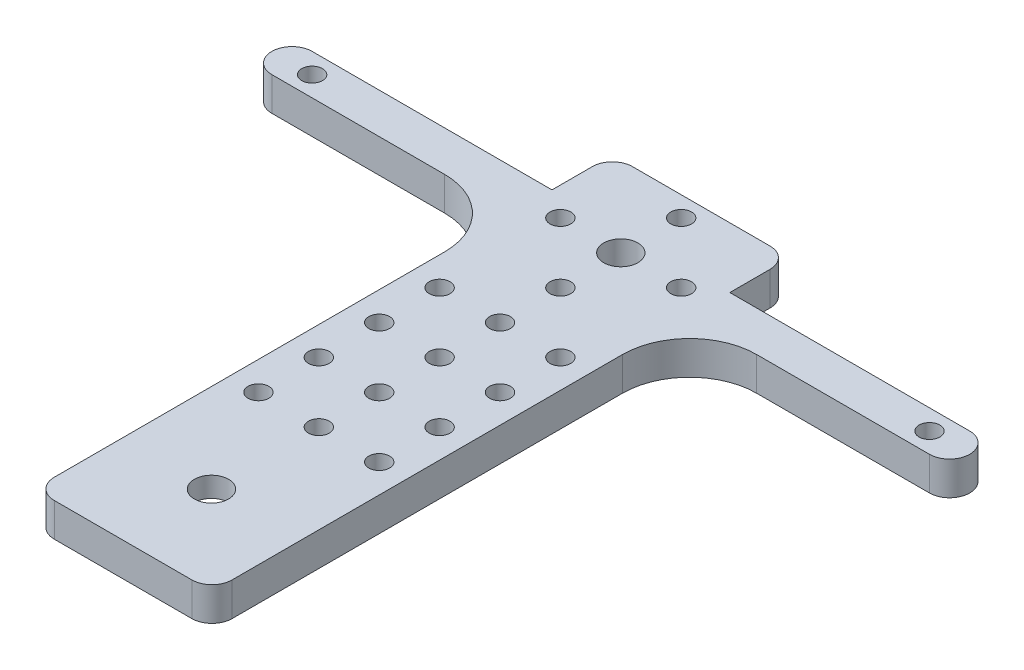
from build123d import *

# Parameters (mm, degrees)
SKETCH1_R           = 1.55
SKETCH1_R_2         = 2.55
BOSS_EXTRUDE1_DEPTH = 5
CUT_EXTRUDE1_DEPTH  = 2


with BuildPart() as part:
    # Sketch1 → Boss-Extrude1 (new body)
    with BuildSketch(Plane(origin=(0, 0, 0), x_dir=(1, 0, 0), z_dir=(0, 1, 0))):
        with BuildLine():
            Line((-13.25, 3), (-49, 3))
            ThreePointArc((-49, 3), (-52, 0), (-49, -3))
            Line((-49, -3), (-23.25, -3))
            ThreePointArc((-23.25, -3), (-16.178932188, -5.928932188), (-13.25, -13))
            Line((-13.25, -13), (-13.25, -71.173549983))
            ThreePointArc((-13.25, -71.173549983), (-12.371320344, -73.294870327), (-10.25, -74.173549983))
            Line((-10.25, -74.173549983), (10.25, -74.173549983))
            ThreePointArc((10.25, -74.173549983), (12.371320344, -73.294870327), (13.25, -71.173549983))
            Line((13.25, -71.173549983), (13.25, -13))
            ThreePointArc((13.25, -13), (16.178932188, -5.928932188), (23.25, -3))
            Line((23.25, -3), (49, -3))
            ThreePointArc((49, -3), (52, 0), (49, 3))
            Line((49, 3), (13.25, 3))
            Line((13.25, 3), (13.25, 9))
            ThreePointArc((13.25, 9), (12.371320344, 11.121320344), (10.25, 12))
            Line((10.25, 12), (-10.25, 12))
            ThreePointArc((-10.25, 12), (-12.371320344, 11.121320344), (-13.25, 9))
            Line((-13.25, 9), (-13.25, 3))
        make_face()
        with Locations(Location((-9, -45, 0), (0, 0, 270))):
            Circle(SKETCH1_R, mode=Mode.SUBTRACT)
        with Locations(Location((-9, -36, 0), (0, 0, 270))):
            Circle(SKETCH1_R, mode=Mode.SUBTRACT)
        with BuildLine():
            ThreePointArc((0, -46.55), (-1.55, -45), (0, -43.45))
            ThreePointArc((0, -43.45), (1.55, -45), (0, -46.55))
        make_face(mode=Mode.SUBTRACT)
        with Locations(Location((9, -45, 0), (0, 0, 270))):
            Circle(SKETCH1_R, mode=Mode.SUBTRACT)
        with BuildLine():
            ThreePointArc((0, -37.55), (-1.55, -36), (0, -34.45))
            ThreePointArc((0, -34.45), (1.55, -36), (0, -37.55))
        make_face(mode=Mode.SUBTRACT)
        with Locations(Location((9, -36, 0), (0, 0, 270))):
            Circle(SKETCH1_R, mode=Mode.SUBTRACT)
        with Locations(Location((-9, -27, 0), (0, 0, 270))):
            Circle(SKETCH1_R, mode=Mode.SUBTRACT)
        with Locations(Location((-9, -18, 0), (0, 0, 270))):
            Circle(SKETCH1_R, mode=Mode.SUBTRACT)
        with Locations(Location((-46, 0, 0), (0, 0, 270))):
            Circle(SKETCH1_R, mode=Mode.SUBTRACT)
        with BuildLine():
            ThreePointArc((0, -10.55), (-1.55, -9), (0, -7.45))
            ThreePointArc((0, -7.45), (1.55, -9), (0, -10.55))
        make_face(mode=Mode.SUBTRACT)
        with Locations(Location((-9, 0, 0), (0, 0, 270))):
            Circle(SKETCH1_R, mode=Mode.SUBTRACT)
        with BuildLine():
            ThreePointArc((0, -28.55), (-1.55, -27), (0, -25.45))
            ThreePointArc((0, -25.45), (1.55, -27), (0, -28.55))
        make_face(mode=Mode.SUBTRACT)
        with Locations(Location((9, -27, 0), (0, 0, 270))):
            Circle(SKETCH1_R, mode=Mode.SUBTRACT)
        with BuildLine():
            ThreePointArc((0, -19.55), (-1.55, -18), (0, -16.45))
            ThreePointArc((0, -16.45), (1.55, -18), (0, -19.55))
        make_face(mode=Mode.SUBTRACT)
        with Locations(Location((9, -18, 0), (0, 0, 270))):
            Circle(SKETCH1_R, mode=Mode.SUBTRACT)
        with BuildLine():
            ThreePointArc((0, -2.55), (-2.55, 0), (0, 2.55))
            ThreePointArc((0, 2.55), (2.55, 0), (0, -2.55))
        make_face(mode=Mode.SUBTRACT)
        with Locations(Location((9, 0, 0), (0, 0, 270))):
            Circle(SKETCH1_R, mode=Mode.SUBTRACT)
        with Locations(Location((0, 9, 0), (0, 0, 270))):
            Circle(SKETCH1_R, mode=Mode.SUBTRACT)
        with Locations(Location((46, 0, 0), (0, 0, 270))):
            Circle(SKETCH1_R, mode=Mode.SUBTRACT)
        with Locations(Location((0, -61, 0), (0, 0, 270))):
            Circle(SKETCH1_R_2, mode=Mode.SUBTRACT)
    extrude(amount=BOSS_EXTRUDE1_DEPTH)

    # Sketch2 → Cut-Extrude1 (cut)
    with BuildSketch(Plane.XZ):
        with BuildLine():
            Line((-11.5, 70.5), (-11.5, 51.5))
            ThreePointArc((-11.5, 51.5), (-10.914213562, 50.085786438), (-9.5, 49.5))
            Line((-9.5, 49.5), (9.5, 49.5))
            ThreePointArc((9.5, 49.5), (10.914213562, 50.085786438), (11.5, 51.5))
            Line((11.5, 51.5), (11.5, 70.5))
            ThreePointArc((11.5, 70.5), (10.914213562, 71.914213562), (9.5, 72.5))
            Line((9.5, 72.5), (-9.5, 72.5))
            ThreePointArc((-9.5, 72.5), (-10.914213562, 71.914213562), (-11.5, 70.5))
        make_face()
    extrude(amount=-CUT_EXTRUDE1_DEPTH, mode=Mode.SUBTRACT)


solid = part.part
